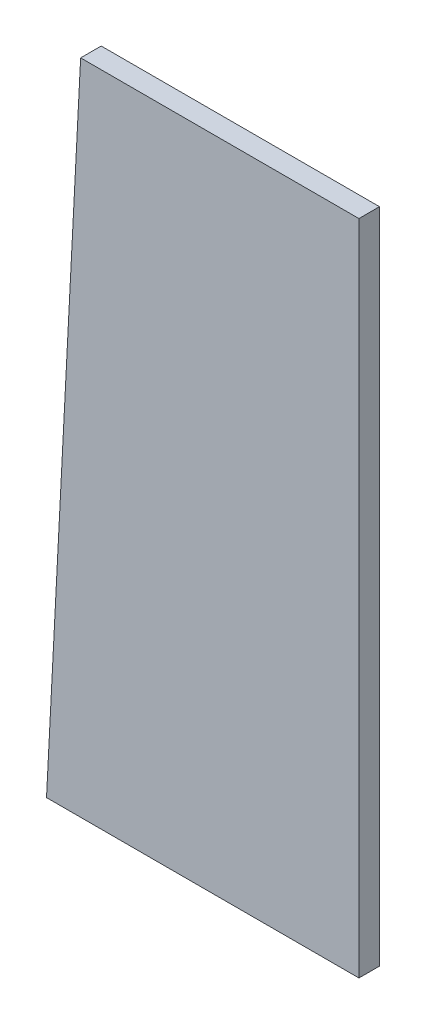
from build123d import *

# Parameters (mm, degrees)
BOSS_EXTRUDE1_DEPTH = 1.5875


with BuildPart() as part:
    # Sketch1 → Boss-Extrude1 (new body)
    with BuildSketch(Plane.XY):
        Polygon((-9.429131685, 25.4), (-12.065, -25.4), (12.065, -25.4), (12.065, 25.4), align=None)
    extrude(amount=BOSS_EXTRUDE1_DEPTH)


solid = part.part
